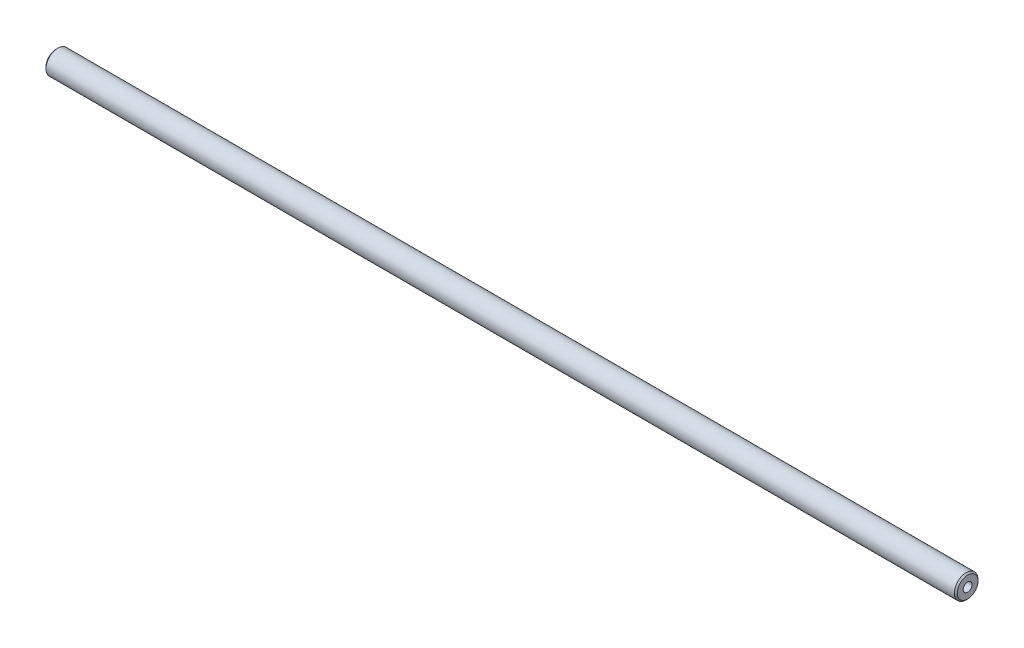
from build123d import *


with BuildPart() as part:
    # Эскиз1 → Повернуть1 (revolve)
    with BuildSketch(Plane.XY, mode=Mode.PRIVATE) as revolve_1_sk:
        Polygon((-146, 1.5), (-146, 0), (146, 0), (146, 1.5), (154, 1.5), (154, 3.5), (153.5, 4), (-153.5, 4), (-154, 3.5), (-154, 1.5), align=None)
    revolve(revolve_1_sk.sketch.rotate(Axis((-154, 0, 0), (1, 0, 0)), 270), axis=Axis((-154, 0, 0), (1, 0, 0)))


solid = part.part
